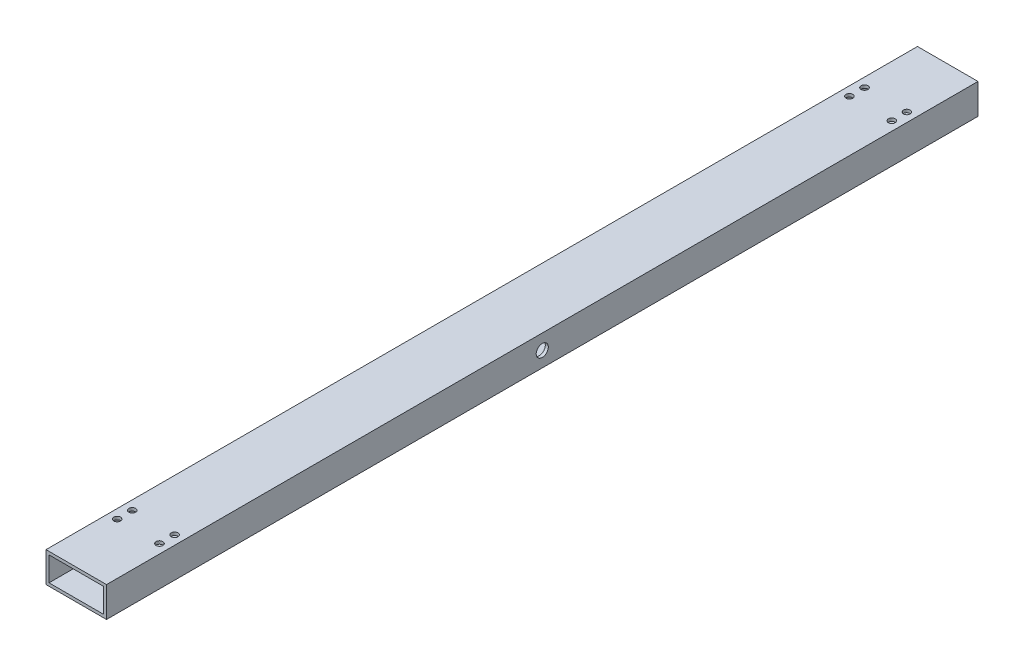
from build123d import *

# Parameters (mm, degrees)
BOSS_EXTRUDE1_DEPTH      = 457.2
BOSS_EXTRUDE1_DEPTH_BACK = 457.2
SKETCH3_W                = 63.5
SKETCH3_H                = 31.75
SKETCH3_W_2              = 57.15
SKETCH3_H_2              = 25.4
SKETCH5_R                = 3.571875
CUT_EXTRUDE1_DEPTH       = 460.399570091
SKETCH6_R                = 6.35
CUT_EXTRUDE2_DEPTH       = 462.861565434


with BuildPart() as part:
    # Sketch3 → Boss-Extrude1 (new, two sides: drawn at the far end of the back side and taken through both)
    with BuildSketch(Plane.XY.offset(-BOSS_EXTRUDE1_DEPTH_BACK)):
        Rectangle(SKETCH3_W, SKETCH3_H)
        Rectangle(SKETCH3_W_2, SKETCH3_H_2, mode=Mode.SUBTRACT)
    extrude(amount=BOSS_EXTRUDE1_DEPTH + BOSS_EXTRUDE1_DEPTH_BACK)

    # Sketch5 → Cut-Extrude1 (cut, through all)
    with BuildSketch(Plane.XZ.offset(15.875)):
        with Locations(Location((-22.225, 392.1125, 0), (0, 0, 270))):
            Circle(SKETCH5_R)
        with Locations(Location((22.225, 392.1125, 0), (0, 0, 270))):
            Circle(SKETCH5_R)
        with Locations(Location((22.225, -392.1125, 0), (0, 0, 90))):
            Circle(SKETCH5_R)
        with Locations(Location((-22.225, -392.1125, 0), (0, 0, 90))):
            Circle(SKETCH5_R)
        with Locations(Location((22.225, 376.2375, 0), (0, 0, 90))):
            Circle(SKETCH5_R)
        with Locations(Location((-22.225, 376.2375, 0), (0, 0, 90))):
            Circle(SKETCH5_R)
        with Locations(Location((22.225, -376.2375, 0), (0, 0, 270))):
            Circle(SKETCH5_R)
        with Locations(Location((-22.225, -376.2375, 0), (0, 0, 270))):
            Circle(SKETCH5_R)
    extrude(amount=-CUT_EXTRUDE1_DEPTH, mode=Mode.SUBTRACT)

    # Sketch6 → Cut-Extrude2 (cut, through all)
    with BuildSketch(Plane.ZY.offset(31.75)):
        with Locations(Location((0, 0, 0), (0, 0, 270))):
            Circle(SKETCH6_R)
    extrude(amount=-CUT_EXTRUDE2_DEPTH, mode=Mode.SUBTRACT)


solid = part.part
